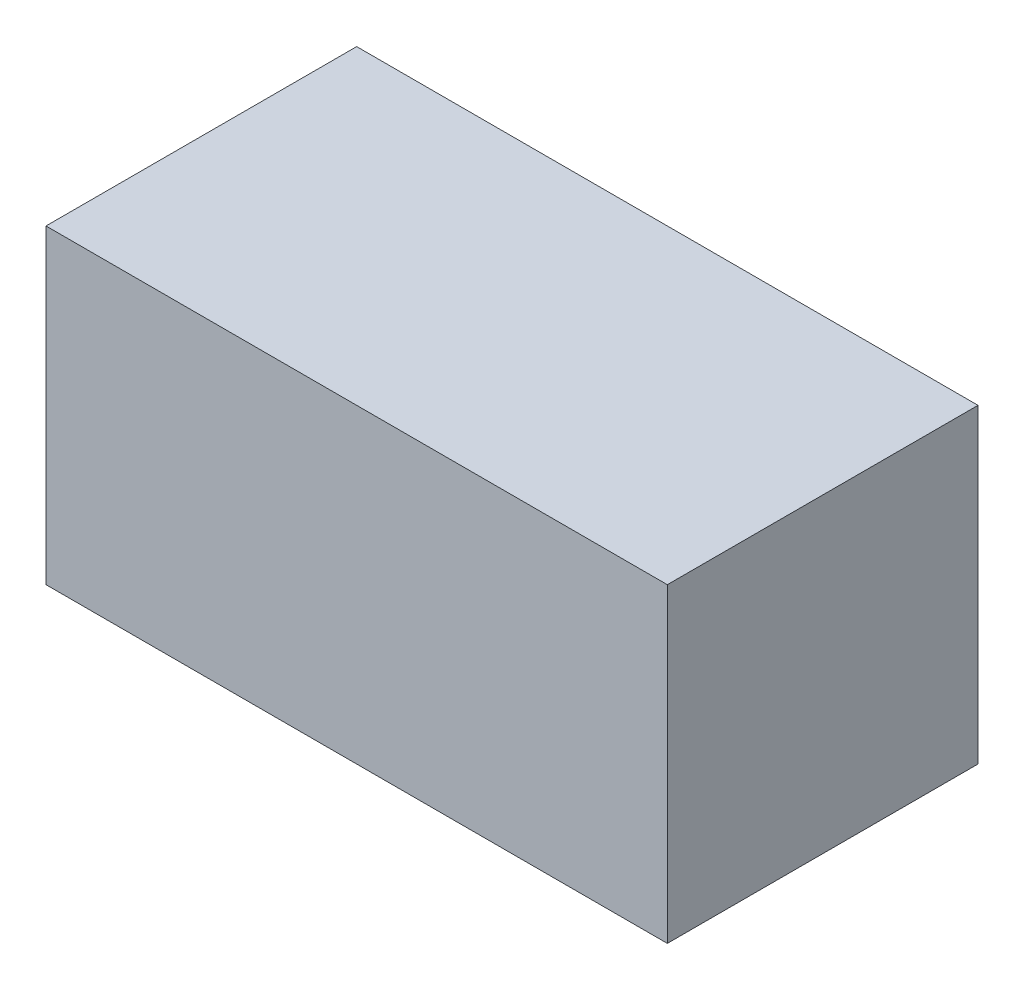
from build123d import *

# Parameters (mm, degrees)
SKETCH1_W           = 20
SKETCH1_H           = 10
BOSS_EXTRUDE1_DEPTH = 10


with BuildPart() as part:
    # Sketch1 → Boss-Extrude1 (new body)
    with BuildSketch(Plane.XY):
        with Locations((10, 5)):
            Rectangle(SKETCH1_W, SKETCH1_H)
    extrude(amount=-BOSS_EXTRUDE1_DEPTH)


solid = part.part
